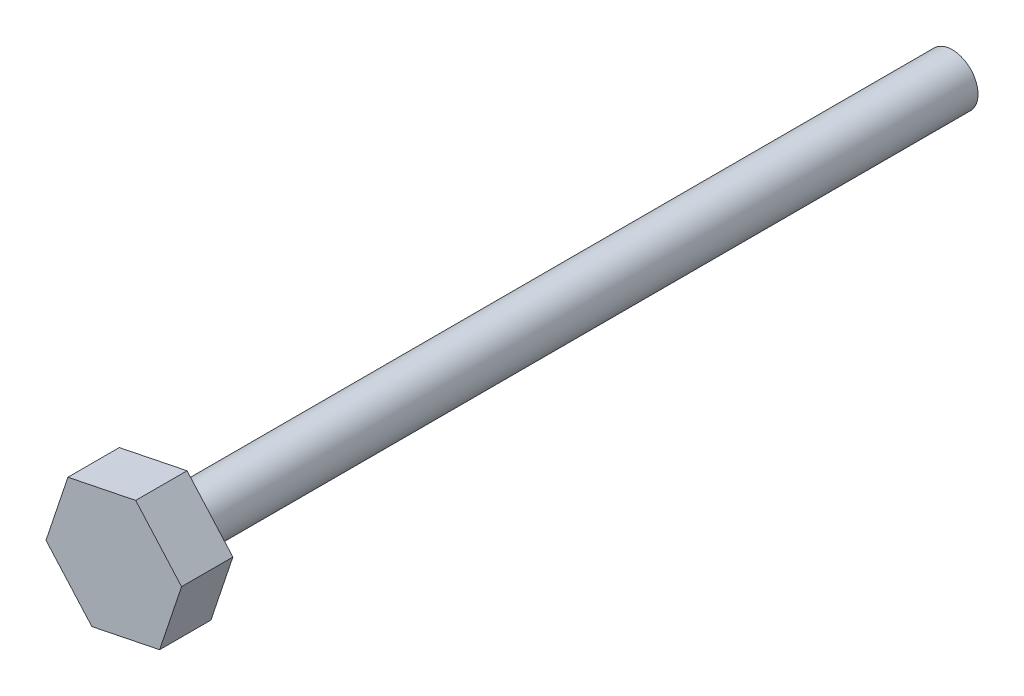
from build123d import *

# Parameters (mm, degrees)
SKETCH1_R           = 1.5
BOSS_EXTRUDE1_DEPTH = 46
BOSS_EXTRUDE2_DEPTH = 3


with BuildPart() as part:
    # Sketch1 → Boss-Extrude1 (new body)
    with BuildSketch(Plane.XY):
        Circle(SKETCH1_R)
    extrude(amount=BOSS_EXTRUDE1_DEPTH)

    # Sketch2 → Boss-Extrude2 (add)
    with BuildSketch(Plane.XY.offset(46)):
        Polygon((1.281341565, 3.832948881), (-2.67876032, 3.026148787), (-3.960101885, -0.806800094), (-1.281341565, -3.832948881), (2.67876032, -3.026148787), (3.960101885, 0.806800094), align=None)
    extrude(amount=BOSS_EXTRUDE2_DEPTH)


solid = part.part
